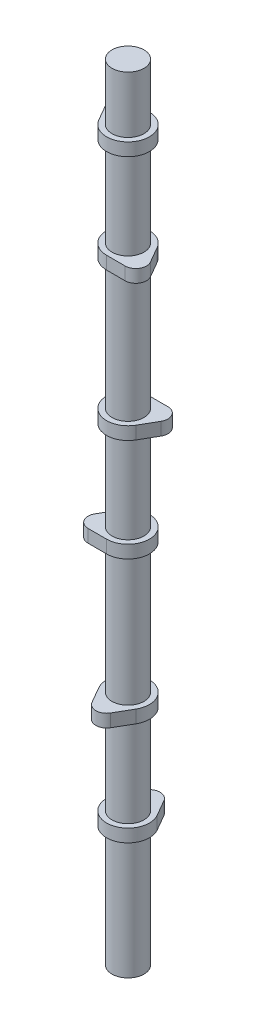
from build123d import *

# Parameters (mm, degrees)
BOSS_EXTRUDE1_DEPTH   = 3.81
BODY_MOVE_COPY2_ANGLE = 180
BOSS_EXTRUDE2_START   = 25.4
SKETCH2_R             = 9.5
BOSS_EXTRUDE2_DEPTH   = 73.025
LPATTERN1_COUNT       = 3
LPATTERN1_PITCH       = 146.05
BODY_MOVE_COPY3_ANGLE = 120
BODY_MOVE_COPY4_ANGLE = 120
SKETCH3_R             = 9.5
BOSS_EXTRUDE3_DEPTH   = 27.94
SCALE1_SCALE          = 0.51948


with BuildPart() as part:
    # Sketch1 → Boss-Extrude1 (new, symmetric)
    with BuildSketch(Plane(origin=(0, 0, 0), x_dir=(1, 0, 0), z_dir=(0, 1, 0))):
        with BuildLine():
            Line((-5.499261314, 15.875), (-10.998522628, 6.35))
            ThreePointArc((-10.998522628, 6.35), (0, -12.7), (10.998522628, 6.35))
            Line((10.998522628, 6.35), (5.499261314, 15.875))
            ThreePointArc((5.499261314, 15.875), (0, 19.05), (-5.499261314, 15.875))
        make_face()
    extrude(amount=BOSS_EXTRUDE1_DEPTH, both=True)


with BuildPart() as body_2:
    # Body-Move/Copy1: copy of part
    add(part.part.moved(Location((0, 60.96, 0))))


with BuildPart() as body_2_1:
    # Body-Move/Copy2: moved
    add(body_2.part.rotate(Axis((0, 0, 0), (0, 1, 0)), BODY_MOVE_COPY2_ANGLE))


with BuildPart() as part_1:
    add(part.part)

    add(body_2_1.part)  # Boss-Extrude2 merges body 2
    # Sketch2 → Boss-Extrude2 (add, symmetric)
    with BuildSketch(Plane(origin=(0, 0, 0), x_dir=(1, 0, 0), z_dir=(0, 1, 0)).offset(BOSS_EXTRUDE2_START)):
        Circle(SKETCH2_R)
    extrude(amount=BOSS_EXTRUDE2_DEPTH, both=True)


with BuildPart() as lpattern1_1:
    # LPattern1: pattern copy
    add(part_1.part.moved(Location(Vector(0, 1, 0) * (1 * LPATTERN1_PITCH))))


with BuildPart() as lpattern1_2:
    # LPattern1: pattern copy
    add(part_1.part.moved(Location(Vector(0, 1, 0) * (2 * LPATTERN1_PITCH))))


with BuildPart() as lpattern1_1_1:
    # Body-Move/Copy3: moved
    add(lpattern1_1.part.rotate(Axis((0, 0, 0), (0, 1, 0)), BODY_MOVE_COPY3_ANGLE))


with BuildPart() as lpattern1_2_1:
    # Body-Move/Copy4: moved
    add(lpattern1_2.part.rotate(Axis((0, 0, 0), (0, -1, 0)), BODY_MOVE_COPY4_ANGLE))


with BuildPart() as part_2:
    add(part_1.part)

    # Sketch3 → Boss-Extrude3 (add)
    with BuildSketch(Plane.XZ.offset(47.625)):
        Circle(SKETCH3_R)
    extrude(amount=BOSS_EXTRUDE3_DEPTH)

    # Combine1: union LPattern1_1, LPattern1_2
    add(lpattern1_1_1.part)
    add(lpattern1_2_1.part)


with BuildPart() as part_3:
    # Scale1: scaled about (0, 159.303825553, 0)
    add(part_2.part.scale(SCALE1_SCALE).moved(Location((0, 76.548674255, 0))))


solid = part_3.part
